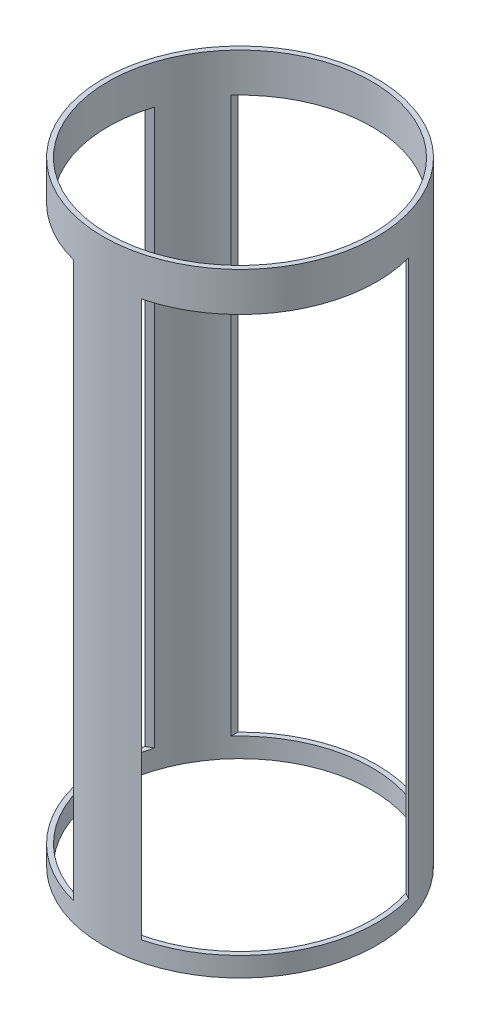
from build123d import *

# Parameters (mm, degrees)
SKETCH1_R               = 88.9
SKETCH1_R_2             = 85.725
BOSS_EXTRUDE1_DEPTH     = 199.39
CUT_EXTRUDE1_REACH      = 237.718
CUT_EXTRUDE1_END_RADIUS = 88.9
SKETCH2_W               = 127
SKETCH2_H               = 360.68
CIRPATTERN1_COUNT       = 3


with BuildPart() as part:
    # Sketch1 → Boss-Extrude1 (new, symmetric)
    with BuildSketch(Plane(origin=(0, 0, 0), x_dir=(1, 0, 0), z_dir=(0, 1, 0))):
        with Locations(Location((0, 0, 0), (0, 0, 270))):
            Circle(SKETCH1_R)
        with Locations(Location((0, 0, 0), (0, 0, 270))):
            Circle(SKETCH1_R_2, mode=Mode.SUBTRACT)
    extrude(amount=BOSS_EXTRUDE1_DEPTH, both=True)

    # Cut-Extrude1: up to this cylinder (the profile starts inside it)
    cut_extrude1_end = Plane(origin=(0, -6.35, 0), z_dir=(0, -1, 0)) * Cylinder(CUT_EXTRUDE1_END_RADIUS, 654.236, mode=Mode.PRIVATE)
    # Sketch2 → Cut-Extrude1 (cut, up to the surface)
    with BuildSketch(Plane.XY, mode=Mode.PRIVATE) as cut_extrude1_sk1:
        with Locations((0, -6.35)):
            Rectangle(SKETCH2_W, SKETCH2_H)
    cut_extrude1_tool1 = extrude(cut_extrude1_sk1.sketch, amount=-CUT_EXTRUDE1_REACH, mode=Mode.PRIVATE) & cut_extrude1_end
    cut_extrude1 = cut_extrude1_tool1.solids().sort_by_distance((0, -6.35, 0))[0]
    add(cut_extrude1, mode=Mode.SUBTRACT)

    # CirPattern1: Cut-Extrude1 ×3 about axis
    cirpattern1_axis = Axis((0, 0, 0), (0, 1, 0))
    for i in range(1, CIRPATTERN1_COUNT):
        add(cut_extrude1.rotate(cirpattern1_axis, i * 360 / CIRPATTERN1_COUNT), mode=Mode.SUBTRACT)


solid = part.part
